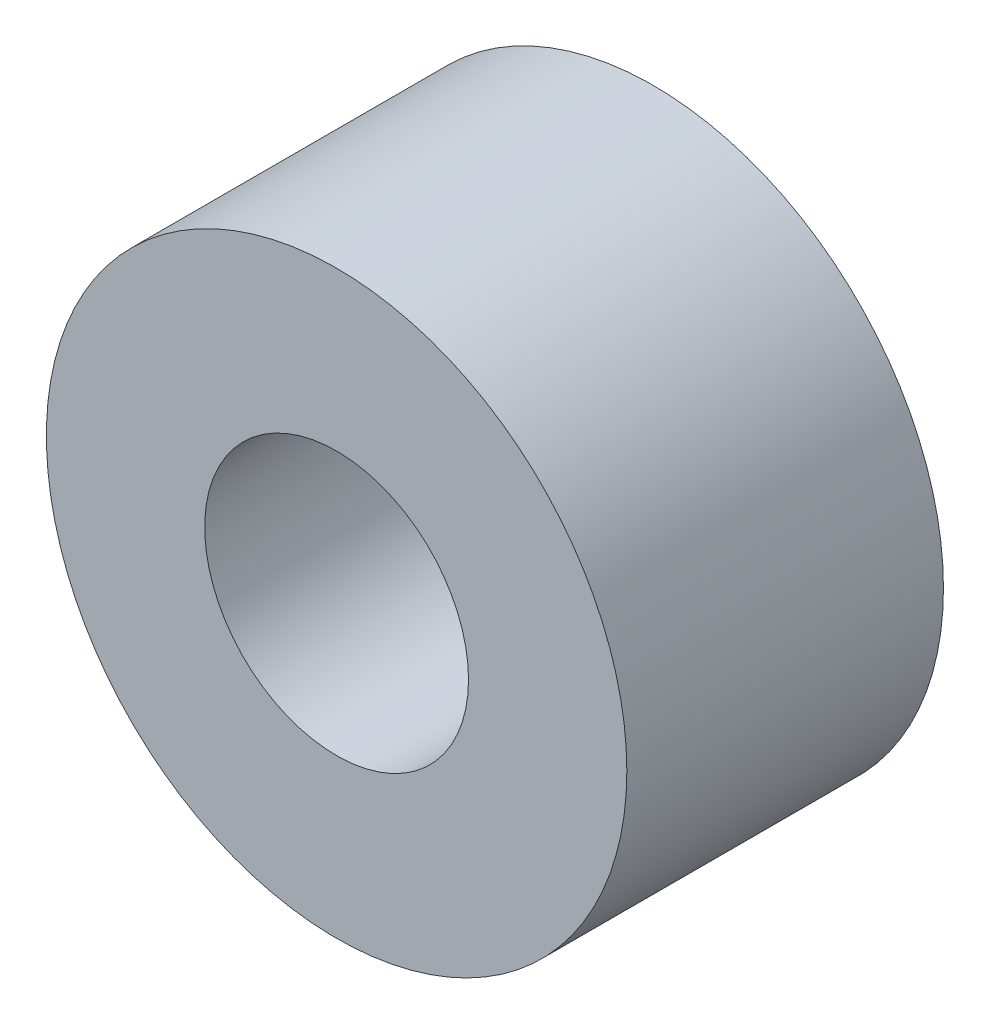
from build123d import *

# Parameters (mm, degrees)
SKETCH_1_R      = 5.5
SKETCH_1_R_2    = 2.5
EXTRUDE_1_DEPTH = 6


with BuildPart() as part:
    # 스케치1 → 보스-돌출1 (new body)
    with BuildSketch(Plane.XY):
        Circle(SKETCH_1_R)
        Circle(SKETCH_1_R_2, mode=Mode.SUBTRACT)
    extrude(amount=EXTRUDE_1_DEPTH)


solid = part.part
